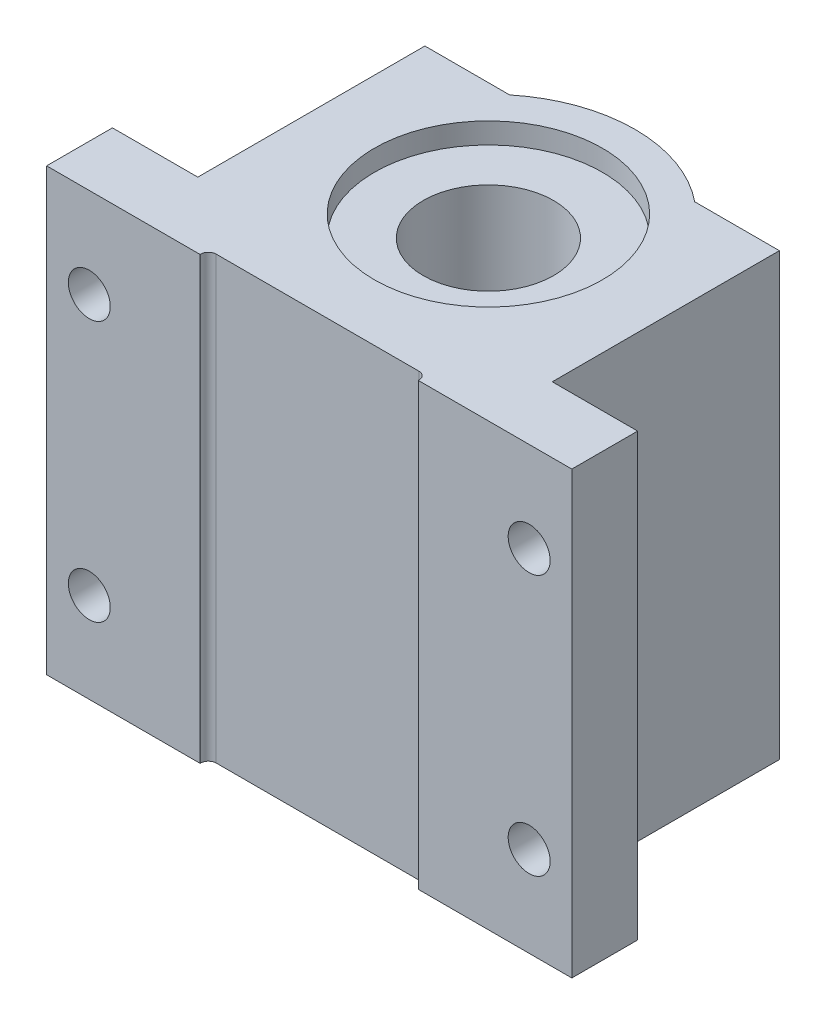
from build123d import *

# Parameters (mm, degrees)
SKETCH1_R           = 6.35
BOSS_EXTRUDE1_DEPTH = 42.9514
SKETCH2_R           = 11.1125
CUT_EXTRUDE1_DEPTH  = 2.032
CUT_EXTRUDE2_START  = -2.032
SKETCH3_R           = 11.1125
CUT_EXTRUDE2_DEPTH  = 2.032
SKETCH8_R           = 2.0447
CUT_EXTRUDE3_DEPTH  = 76.496791448


with BuildPart() as part:
    # Sketch1 → Boss-Extrude1 (new body)
    with BuildSketch(Plane(origin=(0, 0, 0), x_dir=(1, 0, 0), z_dir=(0, 1, 0))):
        with BuildLine():
            Line((-41.729120795, -23.848667038), (-41.729120795, -23.899467038))
            Line((-41.729120795, -23.899467038), (-56.683370795, -23.899467038))
            Line((-56.683370795, -23.899467038), (-56.683370795, -17.485967038))
            Line((-56.683370795, -17.485967038), (-48.364870795, -17.485967038))
            Line((-48.364870795, -17.485967038), (-48.364870795, 4.645738735))
            Line((-48.364870795, 4.645738735), (-40.109870795, 4.645738735))
            ThreePointArc((-40.109870795, 4.645738735), (-31.092870795, 7.850532962), (-22.075870795, 4.645738735))
            Line((-22.075870795, 4.645738735), (-13.820870795, 4.645738735))
            Line((-13.820870795, 4.645738735), (-13.820870795, -17.485967038))
            Line((-13.820870795, -17.485967038), (-5.502370795, -17.485967038))
            Line((-5.502370795, -17.485967038), (-5.502370795, -23.899467038))
            Line((-5.502370795, -23.899467038), (-20.456620795, -23.899467038))
            Line((-20.456620795, -23.899467038), (-20.456620795, -23.848667038))
            ThreePointArc((-20.456620795, -23.848667038), (-20.679805428, -23.309851671), (-21.218620795, -23.086667038))
            Line((-21.218620795, -23.086667038), (-40.967120795, -23.086667038))
            ThreePointArc((-40.967120795, -23.086667038), (-41.505936162, -23.309851671), (-41.729120795, -23.848667038))
        make_face()
        with Locations(Location((-31.092870795, -6.436967038, 0), (0, 0, 270))):
            Circle(SKETCH1_R, mode=Mode.SUBTRACT)
    extrude(amount=BOSS_EXTRUDE1_DEPTH)

    # Sketch2 → Cut-Extrude1 (cut)
    with BuildSketch(Plane(origin=(0, 42.9514, 0), x_dir=(1, 0, 0), z_dir=(0, 1, 0))):
        with Locations(Location((-31.092870795, -6.436967038, 0), (0, 0, 270))):
            Circle(SKETCH2_R)
    extrude(amount=-CUT_EXTRUDE1_DEPTH, mode=Mode.SUBTRACT)

    # Sketch3 → Cut-Extrude2 (cut)
    with BuildSketch(Plane.XZ.offset(CUT_EXTRUDE2_START)):
        with Locations(Location((-31.092870795, 6.436967038, 0), (0, 0, 90))):
            Circle(SKETCH3_R)
    extrude(amount=CUT_EXTRUDE2_DEPTH, mode=Mode.SUBTRACT)

    # Sketch8 → Cut-Extrude3 (cut, through all)
    with BuildSketch(Plane(origin=(0, 0, 17.485967038), x_dir=(-1, 0, 0), z_dir=(0, 0, -1))):
        with Locations((52.524120795, 8.7757)):
            Circle(SKETCH8_R)
        with Locations((52.524120795, 34.1757)):
            Circle(SKETCH8_R)
        with Locations((9.661620795, 8.7757)):
            Circle(SKETCH8_R)
        with Locations((9.661620795, 34.1757)):
            Circle(SKETCH8_R)
    extrude(amount=-CUT_EXTRUDE3_DEPTH, mode=Mode.SUBTRACT)


solid = part.part
